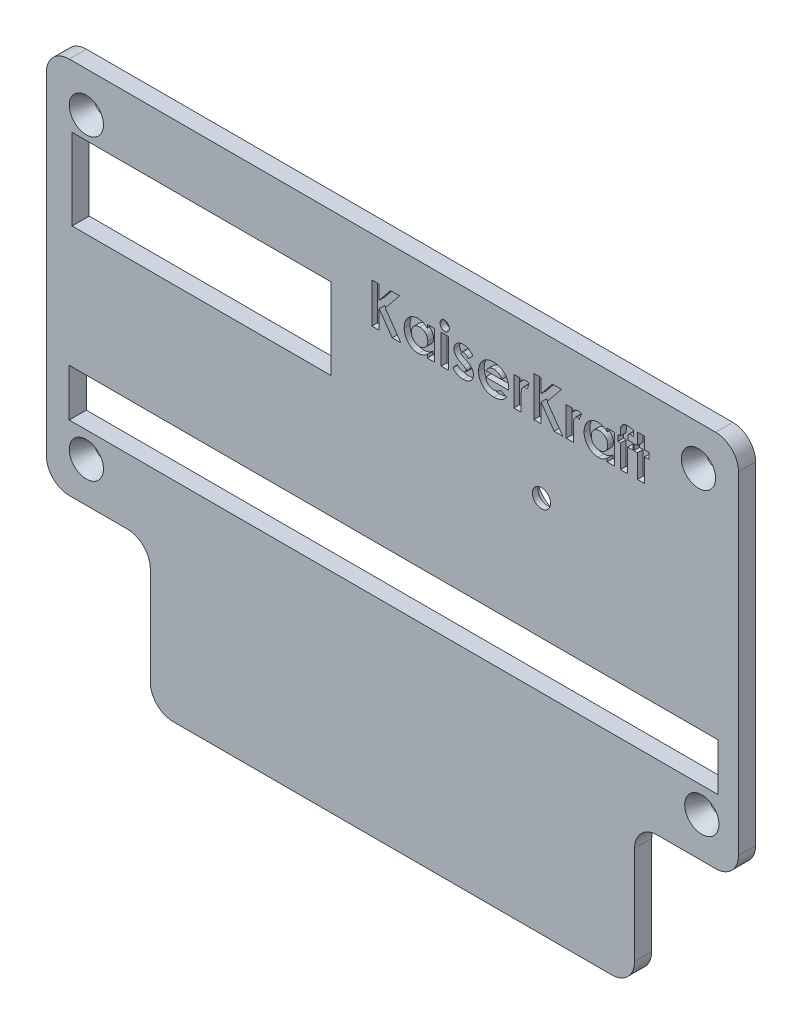
from build123d import *

# Parameters (mm, degrees)
DODANIE_WYCI_GNI_CIE1_DEPTH = 3
SZKIC2_R                    = 1.6
SZKIC2_W                    = 45.3
SZKIC2_H                    = 14.2
SZKIC2_W_2                  = 113.6
SZKIC2_H_2                  = 8.3
WYTNIJ_WYCI_GNI_CIE1_DEPTH  = 3
SZKIC3_R                    = 3.75
WYTNIJ_WYCI_GNI_CIE2_DEPTH  = 2
SZKIC4_R                    = 1.5
WYTNIJ_WYCI_GNI_CIE3_DEPTH  = 134.974773745
SZKIC5_R                    = 3
SZKIC14_R                   = 3
SZKIC15_R                   = 3
SZKIC16_R                   = 3
ZAOKR_GLENIE1_R             = 4
SZKIC17_W                   = 1.256410256
SZKIC17_H                   = 5.115384615
WYTNIJ_WYCI_GNI_CIE5_DEPTH  = 1


with BuildPart() as part:
    # Szkic1 → Dodanie-wyciągnięcie1 (new body)
    with BuildSketch(Plane.XY):
        Polygon((3, -3.2), (3, 63), (-118.2, 63), (-118.2, -3.2), (-100, -3.2), (-100, -28.4), (-15.2, -28.4), (-15.2, -3.2), align=None)
    extrude(amount=DODANIE_WYCI_GNI_CIE1_DEPTH)

    # Szkic2 → Wytnij-wyciągnięcie1 (cut)
    with BuildSketch(Plane.XY.offset(3)):
        with Locations((-31.5, 37.75)):
            Circle(SZKIC2_R)
        with Locations((-91.05, 45.025)):
            Rectangle(SZKIC2_W, SZKIC2_H)
        with Locations((-57.4, 12.4)):
            Rectangle(SZKIC2_W_2, SZKIC2_H_2)
    extrude(amount=-WYTNIJ_WYCI_GNI_CIE1_DEPTH, mode=Mode.SUBTRACT)

    # Szkic3 → Wytnij-wyciągnięcie2 (cut)
    with BuildSketch(Plane(origin=(0, 0, 0), x_dir=(-1, 0, 0), z_dir=(0, 0, -1))):
        with Locations((31.5, 37.75)):
            Circle(SZKIC3_R)
    extrude(amount=-WYTNIJ_WYCI_GNI_CIE2_DEPTH, mode=Mode.SUBTRACT)

    # Szkic4 → Wytnij-wyciągnięcie3 (cut, through all)
    with BuildSketch(Plane.XY.offset(3)):
        with Locations((-111.2, 56)):
            Circle(SZKIC4_R)
        with Locations((-111.2, 3.8)):
            Circle(SZKIC4_R)
        with Locations((-3.417491254, 3.8)):
            Circle(SZKIC4_R)
        with Locations((-4, 56)):
            Circle(SZKIC4_R)
    extrude(amount=-WYTNIJ_WYCI_GNI_CIE3_DEPTH, mode=Mode.SUBTRACT)

    # Szkic5 → section 0 of wyci_cie_wyci_gni_cie_po_profilach5
    with BuildSketch(Plane.XY.offset(3), mode=Mode.PRIVATE) as wyci_cie_wyci_gni_cie_po_profilach5_s0:
        with Locations((-111.2, 56)):
            Circle(SZKIC5_R)
    # loft up to a face of the part (wyci_cie_wyci_gni_cie_po_profilach5)
    loft([wyci_cie_wyci_gni_cie_po_profilach5_s0.sketch, Face(Wire([part.edges().sort_by_distance((-112.226820659, 54.906547059, 0))[0]]))], mode=Mode.SUBTRACT)

    # Szkic14 → section 1 of wyci_cie_wyci_gni_cie_po_profilach6
    with BuildSketch(Plane.XY.offset(3), mode=Mode.PRIVATE) as wyci_cie_wyci_gni_cie_po_profilach6_s1:
        with Locations((-111.2, 3.8)):
            Circle(SZKIC14_R)
    # loft up to a face of the part (wyci_cie_wyci_gni_cie_po_profilach6)
    loft([Face(Wire([part.edges().sort_by_distance((-112.226820659, 2.706547059, 0))[0]])), wyci_cie_wyci_gni_cie_po_profilach6_s1.sketch], mode=Mode.SUBTRACT)

    # Szkic15 → section 1 of wyci_cie_wyci_gni_cie_po_profilach7
    with BuildSketch(Plane.XY.offset(3), mode=Mode.PRIVATE) as wyci_cie_wyci_gni_cie_po_profilach7_s1:
        with Locations((-3.417491254, 3.8)):
            Circle(SZKIC15_R)
    # loft up to a face of the part (wyci_cie_wyci_gni_cie_po_profilach7)
    loft([Face(Wire([part.edges().sort_by_distance((-4.444311913, 2.706547059, 0))[0]])), wyci_cie_wyci_gni_cie_po_profilach7_s1.sketch], mode=Mode.SUBTRACT)

    # Szkic16 → section 1 of wyci_cie_wyci_gni_cie_po_profilach8
    with BuildSketch(Plane.XY.offset(3), mode=Mode.PRIVATE) as wyci_cie_wyci_gni_cie_po_profilach8_s1:
        with Locations((-4, 56)):
            Circle(SZKIC16_R)
    # loft up to a face of the part (wyci_cie_wyci_gni_cie_po_profilach8)
    loft([Face(Wire([part.edges().sort_by_distance((-5.026820659, 54.906547059, 0))[0]])), wyci_cie_wyci_gni_cie_po_profilach8_s1.sketch], mode=Mode.SUBTRACT)

    # Zaokrąglenie1
    zaokr_glenie1_edges = [part.edges().sort_by_distance(p)[0] for p in [
        (-15.2, -3.2, 1.5),
        (-15.2, -28.4, 1.5),
        (-100, -28.4, 1.5),
        (-100, -3.2, 1.5),
        (-118.2, -3.2, 1.5),
        (-118.2, 63, 1.5),
        (3, 63, 1.5),
        (3, -3.2, 1.5),
    ]]
    fillet(zaokr_glenie1_edges, radius=ZAOKR_GLENIE1_R)

    # Szkic17 → Wytnij-wyciągnięcie5 (cut)
    # profile 1 of 12: a face of its own
    with BuildSketch(Plane.XY.offset(3)):
        Polygon((-61.192307692, 56), (-59.935897436, 56), (-59.935897436, 53.536258013), (-57.950320513, 56), (-56.364383013, 56), (-58.858974359, 52.903846154), (-56.121794872, 49), (-57.634815705, 49), (-59.935897436, 52.282652244), (-59.935897436, 49), (-61.192307692, 49), align=None)
    # profile 2 of 12: a face of its own
    with BuildSketch(Plane.XY.offset(3)):
        with BuildLine():
            Line((-51.5, 54.115384615), (-50.243589744, 54.115384615))
            Line((-50.243589744, 54.115384615), (-50.243589744, 49))
            Line((-50.243589744, 49), (-51.5, 49))
            Line((-51.5, 49), (-51.5, 49.558092949))
            add(Edge.make_bspline(
                [(-51.5, 49.558092949), (-51.562254665, 49.503768777), (-51.683078677, 49.398336288), (-51.873458222, 49.261534952), (-52.064394078, 49.14869153), (-52.256803698, 49.058817899), (-52.453644335, 48.992455472), (-52.656333165, 48.944407525), (-52.867789121, 48.916072476), (-53.011533967, 48.912215293), (-53.084535256, 48.91025641)],
                knots=[0, 0, 0, 0, 1.129196829, 2.191548051, 3.199897424, 4.157751732, 5.089409408, 6.034969131, 7.002052659, 8, 8, 8, 8], degree=3))
            add(Edge.make_bspline(
                [(-53.084535256, 48.91025641), (-53.166482449, 48.912099966), (-53.328414745, 48.915742936), (-53.566032412, 48.954091075), (-53.795475893, 49.012791449), (-54.016558944, 49.095859815), (-54.228879323, 49.203500133), (-54.434061926, 49.332903915), (-54.628589297, 49.48861401), (-54.814080811, 49.663893237), (-54.983915729, 49.856701634), (-55.132387017, 50.064363047), (-55.257537279, 50.283932257), (-55.360066191, 50.514681291), (-55.440718421, 50.756440792), (-55.49821192, 51.009977548), (-55.532133151, 51.275382109), (-55.536331644, 51.456165303), (-55.538461538, 51.547876603)],
                knots=[0, 0, 0, 0, 0.980476535, 1.937477201, 2.874147792, 3.812856188, 4.758993464, 5.720109578, 6.712210464, 7.737600662, 8.772720504, 9.783789959, 10.789002326, 11.793715968, 12.802552247, 13.835794126, 14.902098527, 16, 16, 16, 16], degree=3))
            add(Edge.make_bspline(
                [(-55.538461538, 51.547876603), (-55.536226206, 51.642843774), (-55.531841352, 51.829132463), (-55.499766405, 52.102502257), (-55.443333877, 52.362325436), (-55.366384069, 52.608961893), (-55.267401503, 52.842454238), (-55.14684735, 53.063185004), (-55.003081586, 53.270577239), (-54.837417029, 53.46110098), (-54.658539996, 53.635725191), (-54.467173193, 53.787749415), (-54.266309179, 53.916901067), (-54.055734501, 54.022338934), (-53.835479229, 54.103815982), (-53.606412928, 54.163382357), (-53.367518706, 54.199124274), (-53.204782025, 54.203110274), (-53.122395833, 54.205128205)],
                knots=[0, 0, 0, 0, 1.136281865, 2.228943489, 3.287578264, 4.313574083, 5.316051562, 6.317280042, 7.318008486, 8.329309503, 9.333984563, 10.305318864, 11.248632312, 12.186624717, 13.117503092, 14.05354244, 15.014596925, 16, 16, 16, 16], degree=3))
            add(Edge.make_bspline(
                [(-53.122395833, 54.205128205), (-53.046079525, 54.203542718), (-52.895077059, 54.20040561), (-52.673125192, 54.166342623), (-52.457863892, 54.114824773), (-52.250467421, 54.041421111), (-52.049234645, 53.948734054), (-51.857626894, 53.832590263), (-51.671452576, 53.697871209), (-51.557856969, 53.592652775), (-51.5, 53.5390625)],
                knots=[0, 0, 0, 0, 1.017011718, 2.012299608, 2.98747302, 3.965332399, 4.941441765, 5.936729654, 6.94912688, 8, 8, 8, 8], degree=3))
            Line((-51.5, 53.5390625), (-51.5, 54.115384615))
        make_face()
        with BuildLine():
            add(Edge.make_bspline(
                [(-52.858774038, 53.038461538), (-52.908838284, 53.036925395), (-53.006960935, 53.033914653), (-53.151263722, 53.015804832), (-53.289173897, 52.98389452), (-53.419707897, 52.936753887), (-53.544811156, 52.879329728), (-53.662583963, 52.807406913), (-53.773998331, 52.722395675), (-53.878399022, 52.626354134), (-53.973575634, 52.52078692), (-54.055623429, 52.405590217), (-54.125350799, 52.283867922), (-54.184322032, 52.155254057), (-54.226532056, 52.018226723), (-54.259962377, 51.874569772), (-54.27731055, 51.723109601), (-54.280455226, 51.619894182), (-54.282051282, 51.567508013)],
                knots=[0, 0, 0, 0, 1.04836806, 2.054732945, 3.03993516, 4.00574415, 4.955904794, 5.917688631, 6.888591924, 7.88601754, 8.884115178, 9.859153345, 10.841239365, 11.818093293, 12.814750328, 13.83810466, 14.90274714, 16, 16, 16, 16], degree=3))
            add(Edge.make_bspline(
                [(-54.282051282, 51.567508013), (-54.280479606, 51.514646671), (-54.277382638, 51.410484011), (-54.259681874, 51.257746218), (-54.227454514, 51.111990777), (-54.18043601, 50.97439602), (-54.123015511, 50.843105339), (-54.053121851, 50.718724653), (-53.967269731, 50.603453169), (-53.872009686, 50.494563175), (-53.765467232, 50.397328636), (-53.653422435, 50.310993293), (-53.534344855, 50.238756566), (-53.409526397, 50.180374387), (-53.279387206, 50.132797819), (-53.142295732, 50.101288555), (-52.999594959, 50.081145278), (-52.902312073, 50.078340196), (-52.853165064, 50.076923077)],
                knots=[0, 0, 0, 0, 1.099136573, 2.165835871, 3.191374663, 4.196217796, 5.183857741, 6.167377911, 7.154730987, 8.166690795, 9.170734848, 10.148332609, 11.103258353, 12.059567475, 13.009337315, 13.978056681, 14.978520572, 16, 16, 16, 16], degree=3))
            add(Edge.make_bspline(
                [(-52.853165064, 50.076923077), (-52.802168314, 50.078467833), (-52.702186961, 50.081496394), (-52.555529947, 50.099440943), (-52.415767143, 50.131468257), (-52.283480038, 50.178878781), (-52.156648072, 50.235890748), (-52.036415789, 50.306408136), (-51.924087892, 50.391224297), (-51.81909549, 50.488134057), (-51.722890193, 50.59456329), (-51.639707742, 50.711270615), (-51.567252784, 50.83452341), (-51.510270294, 50.967235821), (-51.465018205, 51.107086), (-51.432550875, 51.254941887), (-51.41489053, 51.410962889), (-51.411820647, 51.517453303), (-51.41025641, 51.571714744)],
                knots=[0, 0, 0, 0, 1.050008698, 2.058587853, 3.036635738, 3.995319155, 4.947022481, 5.895997462, 6.858296291, 7.838991643, 8.833936038, 9.806048392, 10.784806122, 11.771666913, 12.772873988, 13.80724452, 14.882696879, 16, 16, 16, 16], degree=3))
            add(Edge.make_bspline(
                [(-51.41025641, 51.571714744), (-51.41180121, 51.625042913), (-51.414818653, 51.72920832), (-51.432627039, 51.881971677), (-51.465324869, 52.02692435), (-51.509645595, 52.164332781), (-51.567641822, 52.293882786), (-51.640151601, 52.414137965), (-51.722421588, 52.52926471), (-51.819692016, 52.632818701), (-51.924115651, 52.729026759), (-52.038095512, 52.811278017), (-52.158040617, 52.882164435), (-52.284687908, 52.940364916), (-52.419210085, 52.983028076), (-52.559211734, 53.0160606), (-52.706877172, 53.033903784), (-52.807315488, 53.036917494), (-52.858774038, 53.038461538)],
                knots=[0, 0, 0, 0, 1.106611376, 2.161533483, 3.185006901, 4.184773755, 5.152708835, 6.122342771, 7.094156588, 8.082475533, 9.064254463, 10.03606828, 10.992420271, 11.951521816, 12.920622147, 13.915721683, 14.932141191, 16, 16, 16, 16], degree=3))
        make_face(mode=Mode.SUBTRACT)
    # profile 3 of 12: a face of its own
    with BuildSketch(Plane.XY.offset(3)):
        with BuildLine():
            add(Edge.make_bspline(
                [(-48.451522436, 56.269230769), (-48.397371163, 56.266573903), (-48.291039921, 56.26135689), (-48.138705947, 56.210502616), (-47.998894231, 56.130688354), (-47.875296798, 56.021181283), (-47.77250001, 55.890409812), (-47.693959446, 55.744002455), (-47.65020777, 55.581787819), (-47.644131309, 55.469731646), (-47.641025641, 55.412459936)],
                knots=[0, 0, 0, 0, 0.989868614, 1.943702388, 2.910836514, 3.924849579, 4.949916355, 5.946401046, 6.950409252, 8, 8, 8, 8], degree=3))
            add(Edge.make_bspline(
                [(-47.641025641, 55.412459936), (-47.644020194, 55.355610287), (-47.649855222, 55.244836039), (-47.694966418, 55.084823542), (-47.770354636, 54.938487296), (-47.873984014, 54.809658024), (-47.99624149, 54.701914629), (-48.132998212, 54.620651387), (-48.283872385, 54.572626126), (-48.388553687, 54.566972999), (-48.441706731, 54.564102564)],
                knots=[0, 0, 0, 0, 1.05296456, 2.051751585, 3.055639087, 4.085634717, 5.099016424, 6.062201612, 7.016062274, 8, 8, 8, 8], degree=3))
            add(Edge.make_bspline(
                [(-48.441706731, 54.564102564), (-48.4963307, 54.566749933), (-48.603587019, 54.571948146), (-48.757170446, 54.622921406), (-48.898846892, 54.702107079), (-49.021908161, 54.813851549), (-49.125882201, 54.945552251), (-49.200992082, 55.095368097), (-49.247975171, 55.258691953), (-49.253552022, 55.372407755), (-49.256410256, 55.430689103)],
                knots=[0, 0, 0, 0, 0.989065327, 1.942068821, 2.907541208, 3.917690034, 4.939857478, 5.938239964, 6.943311734, 8, 8, 8, 8], degree=3))
            add(Edge.make_bspline(
                [(-49.256410256, 55.430689103), (-49.253299716, 55.48657341), (-49.247189509, 55.596350066), (-49.203175755, 55.754958195), (-49.126436124, 55.898904215), (-49.024379791, 56.027281792), (-48.901867959, 56.134746144), (-48.762140175, 56.212136395), (-48.610831414, 56.260890242), (-48.505173742, 56.266421887), (-48.451522436, 56.269230769)],
                knots=[0, 0, 0, 0, 1.038616768, 2.040212704, 3.031499824, 4.052181184, 5.074969369, 6.039807101, 7.004644834, 8, 8, 8, 8], degree=3))
        make_face()
    # profile 4 of 12: a face of its own
    with BuildSketch(Plane.XY.offset(3)):
        with Locations((-48.448717949, 51.557692308)):
            Rectangle(SZKIC17_W, SZKIC17_H)
    # profile 5 of 12: a face of its own
    with BuildSketch(Plane.XY.offset(3)):
        with BuildLine():
            Line((-43.512820513, 53.325921474), (-44.28125, 52.5))
            add(Edge.make_bspline(
                [(-44.28125, 52.5), (-44.319621366, 52.542459996), (-44.393011253, 52.623669885), (-44.505364077, 52.734377114), (-44.616043748, 52.826563533), (-44.72298776, 52.904003966), (-44.82838029, 52.963391522), (-44.931345291, 53.006119538), (-45.031932164, 53.033243918), (-45.098605395, 53.036755066), (-45.131009615, 53.038461538)],
                knots=[0, 0, 0, 0, 1.327646587, 2.539285, 3.655602211, 4.666613517, 5.598770349, 6.454635452, 7.248928967, 8, 8, 8, 8], degree=3))
            add(Edge.make_bspline(
                [(-45.131009615, 53.038461538), (-45.163799431, 53.037462217), (-45.226581728, 53.035548828), (-45.315181618, 53.019136746), (-45.393022548, 52.990724408), (-45.458889762, 52.951995744), (-45.511808647, 52.904286007), (-45.548859626, 52.849707193), (-45.573739699, 52.789956832), (-45.575844392, 52.747513843), (-45.576923077, 52.725761218)],
                knots=[0, 0, 0, 0, 1.295068245, 2.479652818, 3.543291146, 4.55379989, 5.481948265, 6.332409746, 7.145336708, 8, 8, 8, 8], degree=3))
            add(Edge.make_bspline(
                [(-45.576923077, 52.725761218), (-45.573268395, 52.69279659), (-45.565685353, 52.624398815), (-45.513600375, 52.545067601), (-45.444688189, 52.486546589), (-45.365252363, 52.432089427), (-45.25767569, 52.371200489), (-45.176065296, 52.329508054), (-45.131009615, 52.306490385)],
                knots=[0, 0, 0, 0, 0.916701701, 1.902049539, 2.5493345, 3.440293453, 4.586830489, 6, 6, 6, 6], degree=3))
            Line((-45.131009615, 52.306490385), (-44.676682692, 52.076522436))
            add(Edge.make_bspline(
                [(-44.676682692, 52.076522436), (-44.618883621, 52.047173945), (-44.506742565, 51.990232359), (-44.349082746, 51.898349465), (-44.203465623, 51.809289965), (-44.072812234, 51.718016007), (-43.956322896, 51.626113325), (-43.854825027, 51.532673123), (-43.765856792, 51.440657631), (-43.666644722, 51.317290012), (-43.567402876, 51.152974382), (-43.484665998, 50.939289561), (-43.431905697, 50.710480103), (-43.426068378, 50.552112352), (-43.423076923, 50.470953526)],
                knots=[0, 0, 0, 0, 1.076693506, 2.088987655, 3.030641824, 3.911722491, 4.735175175, 5.493635918, 6.202154166, 6.859459289, 8.120623445, 9.372284821, 10.653373066, 12, 12, 12, 12], degree=3))
            add(Edge.make_bspline(
                [(-43.423076923, 50.470953526), (-43.424879294, 50.416200331), (-43.428407012, 50.309033797), (-43.450708501, 50.151294877), (-43.49076775, 50.001308519), (-43.543485662, 49.856736735), (-43.614495109, 49.720193823), (-43.700704057, 49.591017871), (-43.800751235, 49.467512869), (-43.917281534, 49.353903681), (-44.044938528, 49.248021161), (-44.186850819, 49.158966358), (-44.336743663, 49.080666719), (-44.498576993, 49.019521672), (-44.670080084, 48.969949284), (-44.852723074, 48.935596862), (-45.045886215, 48.913978002), (-45.178158497, 48.911518006), (-45.24599359, 48.91025641)],
                knots=[0, 0, 0, 0, 0.976600749, 1.911466839, 2.833459288, 3.740827163, 4.650527853, 5.570709661, 6.506801416, 7.479409329, 8.468875524, 9.458587492, 10.461481786, 11.480119772, 12.538142914, 13.641687514, 14.790552763, 16, 16, 16, 16], degree=3))
            add(Edge.make_bspline(
                [(-45.24599359, 48.91025641), (-45.335869262, 48.913118451), (-45.512287293, 48.918736385), (-45.769933055, 48.957870112), (-46.013219054, 49.025611251), (-46.242345449, 49.120507923), (-46.458715604, 49.241432298), (-46.659239512, 49.391472975), (-46.847393438, 49.566720764), (-46.956863347, 49.701127656), (-47.012820513, 49.769831731)],
                knots=[0, 0, 0, 0, 1.056901255, 2.07460411, 3.05625841, 4.019970729, 4.984811261, 5.963335951, 6.958928997, 8, 8, 8, 8], degree=3))
            Line((-47.012820513, 49.769831731), (-46.251402244, 50.615384615))
            add(Edge.make_bspline(
                [(-46.251402244, 50.615384615), (-46.214303374, 50.576254848), (-46.140649985, 50.498569464), (-46.016500135, 50.39613078), (-45.8851408, 50.302765457), (-45.745109638, 50.224369048), (-45.605050181, 50.161067476), (-45.470674687, 50.113582442), (-45.344515612, 50.083741304), (-45.262490234, 50.079117649), (-45.223557692, 50.076923077)],
                knots=[0, 0, 0, 0, 1.087861918, 2.159761696, 3.243809206, 4.338405912, 5.394481878, 6.343674753, 7.213841449, 8, 8, 8, 8], degree=3))
            add(Edge.make_bspline(
                [(-45.223557692, 50.076923077), (-45.184646224, 50.078049979), (-45.109847643, 50.080216196), (-45.003539491, 50.102749104), (-44.909313677, 50.140630252), (-44.829406678, 50.193153424), (-44.762942175, 50.253442004), (-44.716110675, 50.321960329), (-44.685143207, 50.394615832), (-44.681379474, 50.445413795), (-44.679487179, 50.470953526)],
                knots=[0, 0, 0, 0, 1.255011871, 2.412479185, 3.488767498, 4.514443302, 5.48617286, 6.365347346, 7.178144445, 8, 8, 8, 8], degree=3))
            add(Edge.make_bspline(
                [(-44.679487179, 50.470953526), (-44.681175668, 50.495004559), (-44.68464246, 50.544385965), (-44.712089161, 50.617276455), (-44.755181024, 50.689449736), (-44.814947086, 50.761109296), (-44.892182611, 50.831673704), (-44.986611192, 50.900577762), (-45.09605436, 50.971497586), (-45.176895314, 51.013827224), (-45.219350962, 51.036057692)],
                knots=[0, 0, 0, 0, 0.704666567, 1.446816302, 2.258757648, 3.165368109, 4.175243826, 5.322435858, 6.59381024, 8, 8, 8, 8], degree=3))
            Line((-45.219350962, 51.036057692), (-45.635817308, 51.246394231))
            add(Edge.make_bspline(
                [(-45.635817308, 51.246394231), (-45.7302885, 51.297053464), (-45.911637769, 51.394300197), (-46.156754189, 51.561057677), (-46.364209852, 51.738574334), (-46.534173818, 51.925896487), (-46.669601442, 52.122498466), (-46.764071296, 52.330883397), (-46.823501463, 52.549075745), (-46.830039733, 52.69827804), (-46.833333333, 52.7734375)],
                knots=[0, 0, 0, 0, 1.255999728, 2.41104856, 3.467751088, 4.449286722, 5.368722015, 6.253902015, 7.120417131, 8, 8, 8, 8], degree=3))
            add(Edge.make_bspline(
                [(-46.833333333, 52.7734375), (-46.83219114, 52.822148798), (-46.829948829, 52.917776991), (-46.806078081, 53.058213618), (-46.770014503, 53.193208919), (-46.71912491, 53.322977277), (-46.653936229, 53.447647458), (-46.574068786, 53.566666185), (-46.478548205, 53.679817081), (-46.370432501, 53.786735663), (-46.250474735, 53.884111018), (-46.122102282, 53.970408354), (-45.985694845, 54.043917636), (-45.840132946, 54.102524466), (-45.687266754, 54.149171854), (-45.526087192, 54.180879422), (-45.357281924, 54.201045545), (-45.241846042, 54.203748036), (-45.182892628, 54.205128205)],
                knots=[0, 0, 0, 0, 0.959035663, 1.882742823, 2.798841253, 3.708806893, 4.623422363, 5.566085165, 6.527241613, 7.536786942, 8.55815439, 9.567237405, 10.580975912, 11.605536372, 12.654523293, 13.725718749, 14.838518481, 16, 16, 16, 16], degree=3))
            add(Edge.make_bspline(
                [(-45.182892628, 54.205128205), (-45.101389153, 54.202444775), (-44.939619132, 54.197118638), (-44.701040167, 54.15401951), (-44.470597634, 54.081579824), (-44.248937571, 53.981770051), (-44.038911218, 53.856337531), (-43.845137157, 53.704020089), (-43.666303993, 53.528568471), (-43.564489714, 53.394141249), (-43.512820513, 53.325921474)],
                knots=[0, 0, 0, 0, 0.996590028, 1.978055413, 2.954661574, 3.945146934, 4.945404762, 5.939399542, 6.954276554, 8, 8, 8, 8], degree=3))
        make_face()
    # profile 6 of 12: a face of its own
    with BuildSketch(Plane.XY.offset(3)):
        with BuildLine():
            Line((-37.234975962, 51.243589744), (-41.269230769, 51.243589744))
            add(Edge.make_bspline(
                [(-41.269230769, 51.243589744), (-41.261005249, 51.196713991), (-41.244841454, 51.10459944), (-41.209741198, 50.970795061), (-41.164948007, 50.844700073), (-41.111266188, 50.726145918), (-41.049600817, 50.614505846), (-40.977673269, 50.510303492), (-40.896395883, 50.413630896), (-40.80623858, 50.324908207), (-40.70870412, 50.245410754), (-40.604265508, 50.17576596), (-40.492814971, 50.118661489), (-40.375630247, 50.070528346), (-40.251835697, 50.032402021), (-40.121249126, 50.006107019), (-39.984216699, 49.990574465), (-39.890866024, 49.988327859), (-39.843149038, 49.987179487)],
                knots=[0, 0, 0, 0, 1.091296461, 2.144483647, 3.168565212, 4.157007626, 5.126487748, 6.090021542, 7.05641414, 8.019231907, 8.98705074, 9.938580405, 10.892824166, 11.854447369, 12.841318655, 13.858982407, 14.905600794, 16, 16, 16, 16], degree=3))
            add(Edge.make_bspline(
                [(-39.843149038, 49.987179487), (-39.785551398, 49.988700121), (-39.672124682, 49.991694696), (-39.505953698, 50.018252127), (-39.34524215, 50.05836596), (-39.191510937, 50.118018597), (-39.042979324, 50.192275644), (-38.902092596, 50.284790786), (-38.766412116, 50.392860431), (-38.683631034, 50.476160472), (-38.641426282, 50.518629808)],
                knots=[0, 0, 0, 0, 1.021034703, 2.010718019, 2.977989445, 3.954245119, 4.929443971, 5.918328161, 6.938689359, 8, 8, 8, 8], degree=3))
            Line((-38.641426282, 50.518629808), (-37.58974359, 50.018028846))
            add(Edge.make_bspline(
                [(-37.58974359, 50.018028846), (-37.622855206, 49.972273675), (-37.688464654, 49.881611486), (-37.795569878, 49.754026371), (-37.907340999, 49.634984283), (-38.023861376, 49.525268179), (-38.145278786, 49.425190708), (-38.271255475, 49.333532745), (-38.403632541, 49.252755269), (-38.539763128, 49.178950315), (-38.682461308, 49.11567767), (-38.831332171, 49.061720992), (-38.985745167, 49.012944614), (-39.147650197, 48.975779686), (-39.315699079, 48.946360232), (-39.49029382, 48.925468523), (-39.67141141, 48.912564715), (-39.79451598, 48.911034984), (-39.857171474, 48.91025641)],
                knots=[0, 0, 0, 0, 1.028154879, 2.037251081, 3.030720504, 4.000128189, 4.949298328, 5.894184978, 6.834267904, 7.770992897, 8.712077017, 9.673380525, 10.653304757, 11.658697181, 12.695551717, 13.758623199, 14.859225354, 16, 16, 16, 16], degree=3))
            add(Edge.make_bspline(
                [(-39.857171474, 48.91025641), (-39.953565924, 48.912221603), (-40.142348898, 48.91607032), (-40.418478125, 48.951791921), (-40.680724303, 49.011022185), (-40.929827924, 49.091536633), (-41.164712197, 49.197840928), (-41.385493365, 49.327859898), (-41.59437735, 49.479100821), (-41.784981578, 49.65473784), (-41.958627653, 49.845908293), (-42.111147569, 50.051212306), (-42.238774063, 50.269215496), (-42.343583507, 50.498475073), (-42.425045047, 50.739577852), (-42.483774093, 50.992629044), (-42.519775701, 51.257507789), (-42.523664054, 51.437919782), (-42.525641026, 51.529647436)],
                knots=[0, 0, 0, 0, 1.103565453, 2.161269334, 3.182010356, 4.179077853, 5.15417608, 6.128274628, 7.109042802, 8.101804412, 9.090965879, 10.063106201, 11.02526161, 11.978650795, 12.945248442, 13.93468508, 14.949922959, 16, 16, 16, 16], degree=3))
            add(Edge.make_bspline(
                [(-42.525641026, 51.529647436), (-42.523644596, 51.623706007), (-42.519716711, 51.808762022), (-42.484084066, 52.079756938), (-42.424882681, 52.338322741), (-42.343182848, 52.584815505), (-42.239963377, 52.820006151), (-42.110713055, 53.041837046), (-41.958703341, 53.251080482), (-41.785682822, 53.446757598), (-41.594271135, 53.623377573), (-41.390878134, 53.780781267), (-41.17321849, 53.911940472), (-40.94375412, 54.017917029), (-40.703952762, 54.104020307), (-40.451042646, 54.161314847), (-40.186948035, 54.199784701), (-40.006418774, 54.203327534), (-39.914663462, 54.205128205)],
                knots=[0, 0, 0, 0, 1.079208495, 2.12329425, 3.130605359, 4.119693003, 5.099659317, 6.073216462, 7.060498243, 8.06384408, 9.066070512, 10.045757761, 11.010926815, 11.975797609, 12.942977511, 13.929384301, 14.947594487, 16, 16, 16, 16], degree=3))
            add(Edge.make_bspline(
                [(-39.914663462, 54.205128205), (-39.817807217, 54.203132524), (-39.627639962, 54.199214209), (-39.349587581, 54.163782659), (-39.08560012, 54.104191216), (-38.834552845, 54.024372962), (-38.599651733, 53.915383309), (-38.375735294, 53.788563899), (-38.168174314, 53.634053789), (-37.974756415, 53.459276282), (-37.800157231, 53.265366693), (-37.647538198, 53.05472149), (-37.517678186, 52.829396446), (-37.412425357, 52.588477819), (-37.331047462, 52.332688872), (-37.272264052, 52.062361795), (-37.23653705, 51.776468395), (-37.232721051, 51.580700799), (-37.230769231, 51.48056891)],
                knots=[0, 0, 0, 0, 1.080001299, 2.120471247, 3.119684163, 4.095710327, 5.052285597, 6.002875087, 6.961153713, 7.931888285, 8.906493152, 9.865905668, 10.82813294, 11.801621613, 12.7925306, 13.817193356, 14.883530496, 16, 16, 16, 16], degree=3))
            Line((-37.230769231, 51.48056891), (-37.234975962, 51.243589744))
        make_face()
        with BuildLine():
            add(Edge.make_bspline(
                [(-38.487179487, 52.230769231), (-38.510888717, 52.294750838), (-38.558028843, 52.421962942), (-38.664516424, 52.597484604), (-38.805822038, 52.749493492), (-38.970170604, 52.884068166), (-39.157949131, 52.993297377), (-39.363240389, 53.072382874), (-39.583449537, 53.119803529), (-39.734941564, 53.125365139), (-39.812299679, 53.128205128)],
                knots=[0, 0, 0, 0, 0.954238005, 1.897273737, 2.851915805, 3.847685534, 4.862635127, 5.880135777, 6.917509367, 8, 8, 8, 8], degree=3))
            add(Edge.make_bspline(
                [(-39.812299679, 53.128205128), (-39.896787336, 53.125476973), (-40.061943113, 53.120143998), (-40.300169077, 53.063425852), (-40.524881667, 52.978775713), (-40.657359474, 52.891499623), (-40.723758013, 52.84775641)],
                knots=[0, 0, 0, 0, 1.044195649, 2.041185066, 3.018232172, 4, 4, 4, 4], degree=3))
            add(Edge.make_bspline(
                [(-40.723758013, 52.84775641), (-40.765185742, 52.814440621), (-40.853507543, 52.743413063), (-40.968211319, 52.601719827), (-41.081195494, 52.430161126), (-41.145433227, 52.299850173), (-41.179487179, 52.230769231)],
                knots=[0, 0, 0, 0, 0.82159062, 1.751589201, 2.808063854, 4, 4, 4, 4], degree=3))
            Line((-41.179487179, 52.230769231), (-38.487179487, 52.230769231))
        make_face(mode=Mode.SUBTRACT)
    # profile 7 of 12: a face of its own
    with BuildSketch(Plane.XY.offset(3)):
        with BuildLine():
            Line((-36.333333333, 54.115384615), (-35.256410256, 54.115384615))
            Line((-35.256410256, 54.115384615), (-35.256410256, 53.485777244))
            add(Edge.make_bspline(
                [(-35.256410256, 53.485777244), (-35.22594617, 53.541730624), (-35.166402849, 53.651093827), (-35.057016775, 53.79789227), (-34.931349623, 53.921521823), (-34.793917002, 54.02456831), (-34.64430238, 54.104882929), (-34.486512172, 54.16211722), (-34.321896268, 54.199311578), (-34.20960088, 54.203175368), (-34.152844551, 54.205128205)],
                knots=[0, 0, 0, 0, 1.09866127, 2.147379032, 3.14564304, 4.131443017, 5.102343063, 6.064490016, 7.021754664, 8, 8, 8, 8], degree=3))
            add(Edge.make_bspline(
                [(-34.152844551, 54.205128205), (-34.111632375, 54.203198394), (-34.027709668, 54.199268611), (-33.899799652, 54.176424719), (-33.77004412, 54.135118618), (-33.684653799, 54.097927964), (-33.641025641, 54.078926282)],
                knots=[0, 0, 0, 0, 0.931404136, 1.896671404, 2.925354185, 4, 4, 4, 4], degree=3))
            Line((-33.641025641, 54.078926282), (-34.030849359, 53.014623397))
            add(Edge.make_bspline(
                [(-34.030849359, 53.014623397), (-34.065694033, 53.031458659), (-34.131188606, 53.06310247), (-34.226275354, 53.100445427), (-34.31257052, 53.123230274), (-34.367280071, 53.126629973), (-34.392628205, 53.128205128)],
                knots=[0, 0, 0, 0, 1.214386998, 2.282580073, 3.20428172, 4, 4, 4, 4], degree=3))
            add(Edge.make_bspline(
                [(-34.392628205, 53.128205128), (-34.416561773, 53.127161347), (-34.463643224, 53.12510805), (-34.53313413, 53.107511994), (-34.598580091, 53.077168139), (-34.663134947, 53.038294649), (-34.721706035, 52.984257591), (-34.780240945, 52.921700102), (-34.831825042, 52.844464561), (-34.886261224, 52.758497481), (-34.932611686, 52.653273853), (-34.972355781, 52.527658526), (-35.007768088, 52.380198042), (-35.03213659, 52.21010946), (-35.055689726, 52.019038681), (-35.069709131, 51.805583267), (-35.08015797, 51.570418187), (-35.080796847, 51.406264474), (-35.081129808, 51.320713141)],
                knots=[0, 0, 0, 0, 0.544232178, 1.070598461, 1.618251235, 2.182094276, 2.777567932, 3.425210017, 4.127676488, 4.886675562, 5.738955394, 6.734782583, 7.883056018, 9.186093582, 10.642914445, 12.264202625, 14.053029461, 16, 16, 16, 16], degree=3))
            Line((-35.081129808, 51.320713141), (-35.076923077, 51.071113782))
            Line((-35.076923077, 51.071113782), (-35.076923077, 49))
            Line((-35.076923077, 49), (-36.333333333, 49))
            Line((-36.333333333, 49), (-36.333333333, 54.115384615))
        make_face()
    # profile 8 of 12: a face of its own
    with BuildSketch(Plane.XY.offset(3)):
        Polygon((-32.833333333, 56), (-31.576923077, 56), (-31.576923077, 53.536258013), (-29.591346154, 56), (-28.005408654, 56), (-30.5, 52.903846154), (-27.762820513, 49), (-29.275841346, 49), (-31.576923077, 52.282652244), (-31.576923077, 49), (-32.833333333, 49), align=None)
    # profile 9 of 12: a face of its own
    with BuildSketch(Plane.XY.offset(3)):
        with BuildLine():
            Line((-27.179487179, 54.115384615), (-26.102564103, 54.115384615))
            Line((-26.102564103, 54.115384615), (-26.102564103, 53.485777244))
            add(Edge.make_bspline(
                [(-26.102564103, 53.485777244), (-26.072100016, 53.541730624), (-26.012556695, 53.651093827), (-25.903170621, 53.79789227), (-25.777503469, 53.921521823), (-25.640070848, 54.02456831), (-25.490456226, 54.104882929), (-25.332666018, 54.16211722), (-25.168050115, 54.199311578), (-25.055754726, 54.203175368), (-24.998998397, 54.205128205)],
                knots=[0, 0, 0, 0, 1.09866127, 2.147379032, 3.14564304, 4.131443017, 5.102343063, 6.064490016, 7.021754664, 8, 8, 8, 8], degree=3))
            add(Edge.make_bspline(
                [(-24.998998397, 54.205128205), (-24.957786221, 54.203198394), (-24.873863514, 54.199268611), (-24.745953498, 54.176424719), (-24.616197966, 54.135118618), (-24.530807645, 54.097927964), (-24.487179487, 54.078926282)],
                knots=[0, 0, 0, 0, 0.931404136, 1.896671404, 2.925354185, 4, 4, 4, 4], degree=3))
            Line((-24.487179487, 54.078926282), (-24.877003205, 53.014623397))
            add(Edge.make_bspline(
                [(-24.877003205, 53.014623397), (-24.911847879, 53.031458659), (-24.977342452, 53.06310247), (-25.0724292, 53.100445427), (-25.158724366, 53.123230274), (-25.213433917, 53.126629973), (-25.238782051, 53.128205128)],
                knots=[0, 0, 0, 0, 1.214386998, 2.282580073, 3.20428172, 4, 4, 4, 4], degree=3))
            add(Edge.make_bspline(
                [(-25.238782051, 53.128205128), (-25.262715619, 53.127161347), (-25.309797071, 53.12510805), (-25.379287976, 53.107511994), (-25.444733938, 53.077168139), (-25.509288794, 53.038294649), (-25.567859881, 52.984257591), (-25.626394791, 52.921700102), (-25.677978888, 52.844464561), (-25.73241507, 52.758497481), (-25.778765532, 52.653273853), (-25.818509627, 52.527658526), (-25.853921934, 52.380198042), (-25.878290436, 52.21010946), (-25.901843572, 52.019038681), (-25.915862977, 51.805583267), (-25.926311817, 51.570418187), (-25.926950693, 51.406264474), (-25.927283654, 51.320713141)],
                knots=[0, 0, 0, 0, 0.544232178, 1.070598461, 1.618251235, 2.182094276, 2.777567932, 3.425210017, 4.127676488, 4.886675562, 5.738955394, 6.734782583, 7.883056018, 9.186093582, 10.642914445, 12.264202625, 14.053029461, 16, 16, 16, 16], degree=3))
            Line((-25.927283654, 51.320713141), (-25.923076923, 51.071113782))
            Line((-25.923076923, 51.071113782), (-25.923076923, 49))
            Line((-25.923076923, 49), (-27.179487179, 49))
            Line((-27.179487179, 49), (-27.179487179, 54.115384615))
        make_face()
    # profile 10 of 12: a face of its own
    with BuildSketch(Plane.XY.offset(3)):
        with BuildLine():
            Line((-20, 54.115384615), (-18.743589744, 54.115384615))
            Line((-18.743589744, 54.115384615), (-18.743589744, 49))
            Line((-18.743589744, 49), (-20, 49))
            Line((-20, 49), (-20, 49.558092949))
            add(Edge.make_bspline(
                [(-20, 49.558092949), (-20.062254665, 49.503768777), (-20.183078677, 49.398336288), (-20.373458222, 49.261534952), (-20.564394078, 49.14869153), (-20.756803698, 49.058817899), (-20.953644335, 48.992455472), (-21.156333165, 48.944407525), (-21.367789121, 48.916072476), (-21.511533967, 48.912215293), (-21.584535256, 48.91025641)],
                knots=[0, 0, 0, 0, 1.129196829, 2.191548051, 3.199897424, 4.157751732, 5.089409408, 6.034969131, 7.002052659, 8, 8, 8, 8], degree=3))
            add(Edge.make_bspline(
                [(-21.584535256, 48.91025641), (-21.666482449, 48.912099966), (-21.828414745, 48.915742936), (-22.066032412, 48.954091075), (-22.295475893, 49.012791449), (-22.516558944, 49.095859815), (-22.728879323, 49.203500133), (-22.934061926, 49.332903915), (-23.128589297, 49.48861401), (-23.314080811, 49.663893237), (-23.483915729, 49.856701634), (-23.632387017, 50.064363047), (-23.757537279, 50.283932257), (-23.860066191, 50.514681291), (-23.940718421, 50.756440792), (-23.99821192, 51.009977548), (-24.032133151, 51.275382109), (-24.036331644, 51.456165303), (-24.038461538, 51.547876603)],
                knots=[0, 0, 0, 0, 0.980476535, 1.937477201, 2.874147792, 3.812856188, 4.758993464, 5.720109578, 6.712210464, 7.737600662, 8.772720504, 9.783789959, 10.789002326, 11.793715968, 12.802552247, 13.835794126, 14.902098527, 16, 16, 16, 16], degree=3))
            add(Edge.make_bspline(
                [(-24.038461538, 51.547876603), (-24.036226206, 51.642843774), (-24.031841352, 51.829132463), (-23.999766405, 52.102502257), (-23.943333877, 52.362325436), (-23.866384069, 52.608961893), (-23.767401503, 52.842454238), (-23.64684735, 53.063185004), (-23.503081586, 53.270577239), (-23.337417029, 53.46110098), (-23.158539996, 53.635725191), (-22.967173193, 53.787749415), (-22.766309179, 53.916901067), (-22.555734501, 54.022338934), (-22.335479229, 54.103815982), (-22.106412928, 54.163382357), (-21.867518706, 54.199124274), (-21.704782025, 54.203110274), (-21.622395833, 54.205128205)],
                knots=[0, 0, 0, 0, 1.136281865, 2.228943489, 3.287578264, 4.313574083, 5.316051562, 6.317280042, 7.318008486, 8.329309503, 9.333984563, 10.305318864, 11.248632312, 12.186624717, 13.117503092, 14.05354244, 15.014596925, 16, 16, 16, 16], degree=3))
            add(Edge.make_bspline(
                [(-21.622395833, 54.205128205), (-21.546079525, 54.203542718), (-21.395077059, 54.20040561), (-21.173125192, 54.166342623), (-20.957863892, 54.114824773), (-20.750467421, 54.041421111), (-20.549234645, 53.948734054), (-20.357626894, 53.832590263), (-20.171452576, 53.697871209), (-20.057856969, 53.592652775), (-20, 53.5390625)],
                knots=[0, 0, 0, 0, 1.017011718, 2.012299608, 2.98747302, 3.965332399, 4.941441765, 5.936729654, 6.94912688, 8, 8, 8, 8], degree=3))
            Line((-20, 53.5390625), (-20, 54.115384615))
        make_face()
        with BuildLine():
            add(Edge.make_bspline(
                [(-21.358774038, 53.038461538), (-21.408838284, 53.036925395), (-21.506960935, 53.033914653), (-21.651263722, 53.015804832), (-21.789173897, 52.98389452), (-21.919707897, 52.936753887), (-22.044811156, 52.879329728), (-22.162583963, 52.807406913), (-22.273998331, 52.722395675), (-22.378399022, 52.626354134), (-22.473575634, 52.52078692), (-22.555623429, 52.405590217), (-22.625350799, 52.283867922), (-22.684322032, 52.155254057), (-22.726532056, 52.018226723), (-22.759962377, 51.874569772), (-22.77731055, 51.723109601), (-22.780455226, 51.619894182), (-22.782051282, 51.567508013)],
                knots=[0, 0, 0, 0, 1.04836806, 2.054732945, 3.03993516, 4.00574415, 4.955904794, 5.917688631, 6.888591924, 7.88601754, 8.884115178, 9.859153345, 10.841239365, 11.818093293, 12.814750328, 13.83810466, 14.90274714, 16, 16, 16, 16], degree=3))
            add(Edge.make_bspline(
                [(-22.782051282, 51.567508013), (-22.780479606, 51.514646671), (-22.777382638, 51.410484011), (-22.759681874, 51.257746218), (-22.727454514, 51.111990777), (-22.68043601, 50.97439602), (-22.623015511, 50.843105339), (-22.553121851, 50.718724653), (-22.467269731, 50.603453169), (-22.372009686, 50.494563175), (-22.265467232, 50.397328636), (-22.153422435, 50.310993293), (-22.034344855, 50.238756566), (-21.909526397, 50.180374387), (-21.779387206, 50.132797819), (-21.642295732, 50.101288555), (-21.499594959, 50.081145278), (-21.402312073, 50.078340196), (-21.353165064, 50.076923077)],
                knots=[0, 0, 0, 0, 1.099136573, 2.165835871, 3.191374663, 4.196217796, 5.183857741, 6.167377911, 7.154730987, 8.166690795, 9.170734848, 10.148332609, 11.103258353, 12.059567475, 13.009337315, 13.978056681, 14.978520572, 16, 16, 16, 16], degree=3))
            add(Edge.make_bspline(
                [(-21.353165064, 50.076923077), (-21.302168314, 50.078467833), (-21.202186961, 50.081496394), (-21.055529947, 50.099440943), (-20.915767143, 50.131468257), (-20.783480038, 50.178878781), (-20.656648072, 50.235890748), (-20.536415789, 50.306408136), (-20.424087892, 50.391224297), (-20.31909549, 50.488134057), (-20.222890193, 50.59456329), (-20.139707742, 50.711270615), (-20.067252784, 50.83452341), (-20.010270294, 50.967235821), (-19.965018205, 51.107086), (-19.932550875, 51.254941887), (-19.91489053, 51.410962889), (-19.911820647, 51.517453303), (-19.91025641, 51.571714744)],
                knots=[0, 0, 0, 0, 1.050008698, 2.058587853, 3.036635738, 3.995319155, 4.947022481, 5.895997462, 6.858296291, 7.838991643, 8.833936038, 9.806048392, 10.784806122, 11.771666913, 12.772873988, 13.80724452, 14.882696879, 16, 16, 16, 16], degree=3))
            add(Edge.make_bspline(
                [(-19.91025641, 51.571714744), (-19.91180121, 51.625042913), (-19.914818653, 51.72920832), (-19.932627039, 51.881971677), (-19.965324869, 52.02692435), (-20.009645595, 52.164332781), (-20.067641822, 52.293882786), (-20.140151601, 52.414137965), (-20.222421588, 52.52926471), (-20.319692016, 52.632818701), (-20.424115651, 52.729026759), (-20.538095512, 52.811278017), (-20.658040617, 52.882164435), (-20.784687908, 52.940364916), (-20.919210085, 52.983028076), (-21.059211734, 53.0160606), (-21.206877172, 53.033903784), (-21.307315488, 53.036917494), (-21.358774038, 53.038461538)],
                knots=[0, 0, 0, 0, 1.106611376, 2.161533483, 3.185006901, 4.184773755, 5.152708835, 6.122342771, 7.094156588, 8.082475533, 9.064254463, 10.03606828, 10.992420271, 11.951521816, 12.920622147, 13.915721683, 14.932141191, 16, 16, 16, 16], degree=3))
        make_face(mode=Mode.SUBTRACT)
    # profile 11 of 12: a face of its own
    with BuildSketch(Plane.XY.offset(3)):
        with BuildLine():
            Line((-18.115384615, 54.115384615), (-17.666666667, 54.115384615))
            add(Edge.make_bspline(
                [(-17.666666667, 54.115384615), (-17.6663668, 54.196716359), (-17.665799791, 54.350503628), (-17.662451137, 54.568309184), (-17.660192975, 54.75996795), (-17.656159399, 54.925450447), (-17.650482571, 55.064271947), (-17.644663223, 55.176424863), (-17.64030414, 55.262616813), (-17.634158413, 55.311050602), (-17.631610577, 55.331129808)],
                knots=[0, 0, 0, 0, 1.604323161, 3.033556972, 4.296844687, 5.385167547, 6.298701784, 7.037230881, 7.60086462, 8, 8, 8, 8], degree=3))
            add(Edge.make_bspline(
                [(-17.631610577, 55.331129808), (-17.61966347, 55.400019028), (-17.596374515, 55.534307433), (-17.519280553, 55.721478275), (-17.407256812, 55.884525506), (-17.288504768, 55.999612861), (-17.178452069, 56.078180086), (-17.086126999, 56.129495151), (-16.985740309, 56.173487847), (-16.876967652, 56.207983394), (-16.760843527, 56.236161845), (-16.636114755, 56.255750107), (-16.503465639, 56.266544958), (-16.412145239, 56.268321229), (-16.365384615, 56.269230769)],
                knots=[0, 0, 0, 0, 1.43722947, 2.801646624, 4.13175475, 5.486897933, 6.18427957, 6.91287343, 7.658885333, 8.438447905, 9.260561323, 10.118602268, 11.036630026, 12, 12, 12, 12], degree=3))
            add(Edge.make_bspline(
                [(-16.365384615, 56.269230769), (-16.293739652, 56.26699498), (-16.1445176, 56.262338281), (-15.915250057, 56.224691733), (-15.67201319, 56.167060963), (-15.508255827, 56.113432086), (-15.423076923, 56.085536859)],
                knots=[0, 0, 0, 0, 0.891275659, 1.856347963, 2.884972697, 4, 4, 4, 4], degree=3))
            Line((-15.423076923, 56.085536859), (-15.423076923, 55.108173077))
            add(Edge.make_bspline(
                [(-15.423076923, 55.108173077), (-15.468763891, 55.120804753), (-15.555899151, 55.144896184), (-15.681272985, 55.171639812), (-15.794238612, 55.188153936), (-15.865206166, 55.190982967), (-15.8984375, 55.192307692)],
                knots=[0, 0, 0, 0, 1.174725213, 2.24046353, 3.176077791, 4, 4, 4, 4], degree=3))
            add(Edge.make_bspline(
                [(-15.8984375, 55.192307692), (-15.935010922, 55.191536976), (-16.003543875, 55.190092771), (-16.098540524, 55.171719674), (-16.179877909, 55.142790416), (-16.222066577, 55.109751108), (-16.241987179, 55.094150641)],
                knots=[0, 0, 0, 0, 1.199997209, 2.248609783, 3.173030359, 4, 4, 4, 4], degree=3))
            add(Edge.make_bspline(
                [(-16.241987179, 55.094150641), (-16.254041627, 55.078752104), (-16.280673842, 55.044731703), (-16.304880816, 54.975310867), (-16.317170427, 54.887569057), (-16.319329752, 54.822635574), (-16.320512821, 54.787059295)],
                knots=[0, 0, 0, 0, 0.721105823, 1.593158367, 2.681320256, 4, 4, 4, 4], degree=3))
            Line((-16.320512821, 54.787059295), (-16.324719551, 54.115384615))
            Line((-16.324719551, 54.115384615), (-15.512820513, 54.115384615))
            Line((-15.512820513, 54.115384615), (-15.512820513, 53.038461538))
            Line((-15.512820513, 53.038461538), (-16.41025641, 53.038461538))
            Line((-16.41025641, 53.038461538), (-16.41025641, 49))
            Line((-16.41025641, 49), (-17.666666667, 49))
            Line((-17.666666667, 49), (-17.666666667, 53.038461538))
            Line((-17.666666667, 53.038461538), (-18.115384615, 53.038461538))
            Line((-18.115384615, 53.038461538), (-18.115384615, 54.115384615))
        make_face()
    # profile 12 of 12: a face of its own
    with BuildSketch(Plane.XY.offset(3)):
        Polygon((-14.705128205, 56.179487179), (-13.448717949, 56.179487179), (-13.448717949, 54.115384615), (-12.641025641, 54.115384615), (-12.641025641, 53.038461538), (-13.448717949, 53.038461538), (-13.448717949, 49), (-14.705128205, 49), (-14.705128205, 53.038461538), (-15.333333333, 53.038461538), (-15.333333333, 54.115384615), (-14.705128205, 54.115384615), align=None)
    extrude(amount=-WYTNIJ_WYCI_GNI_CIE5_DEPTH, mode=Mode.SUBTRACT)


solid = part.part
